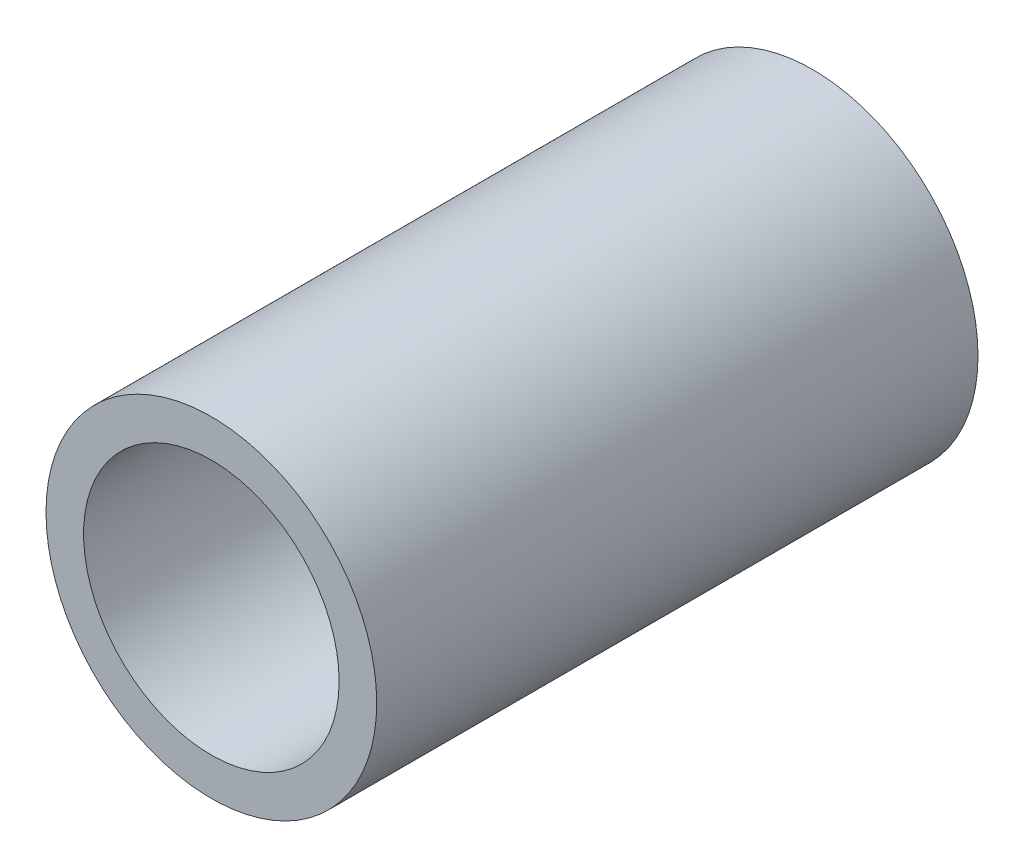
from build123d import *

# Parameters (mm, degrees)
SKETCH1_R           = 11
SKETCH1_R_2         = 8.5
BOSS_EXTRUDE1_DEPTH = 40


with BuildPart() as part:
    # Sketch1 → Boss-Extrude1 (new body)
    with BuildSketch(Plane.XY):
        Circle(SKETCH1_R)
        Circle(SKETCH1_R_2, mode=Mode.SUBTRACT)
    extrude(amount=BOSS_EXTRUDE1_DEPTH)


solid = part.part
